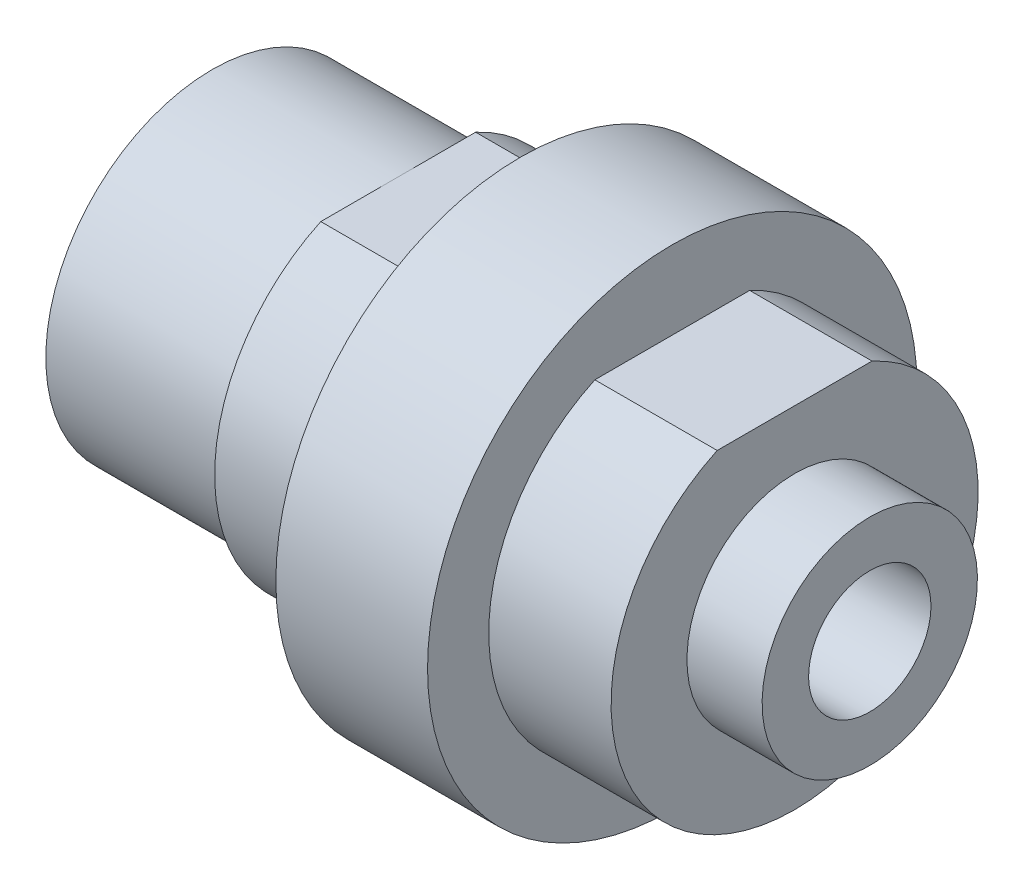
from build123d import *

# Parameters (mm, degrees)
CUT_EXTRUDE1_DEPTH      = 39.565038065
CUT_EXTRUDE1_DEPTH_BACK = 39.565038065
SKETCH2_W               = 6.35
SKETCH2_H               = 0.889


with BuildPart() as part:
    # Sketch1 → Revolve1 (revolve)
    with BuildSketch(Plane.XY):
        Polygon((0, 8.636), (0, 3.175), (34.12744, 3.175), (34.12744, 5.588), (30.226, 5.588), (30.226, 9.525), (23.876, 9.525), (23.876, 12.7), (16.002, 12.7), (16.002, 9.525), (9.652, 9.525), (9.652, 8.636), align=None)
    revolve(axis=Axis((34.12744, 0, 0), (-1, 0, 0)))

    # Sketch2 → Cut-Extrude1 (cut, two sides: drawn at the far end of the back side and taken through both)
    with BuildSketch(Plane.XY.offset(-CUT_EXTRUDE1_DEPTH_BACK)):
        with Locations((12.827, 9.0805)):
            Rectangle(SKETCH2_W, SKETCH2_H)
        with Locations((27.051, 9.0805)):
            Rectangle(SKETCH2_W, SKETCH2_H)
    extrude(amount=CUT_EXTRUDE1_DEPTH + CUT_EXTRUDE1_DEPTH_BACK, mode=Mode.SUBTRACT)


solid = part.part
